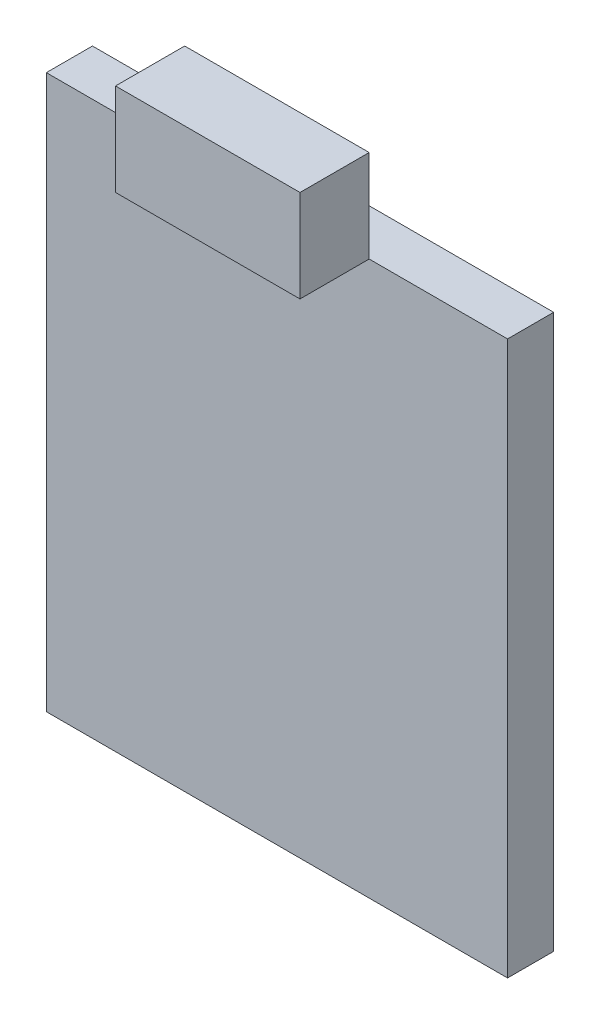
from build123d import *

# Parameters (mm, degrees)
SKETCH1_W           = 15.875
SKETCH1_H           = 19.05
BOSS_EXTRUDE1_DEPTH = 1.5875
SKETCH3_W           = 6.35
SKETCH3_H           = 3.175
BOSS_EXTRUDE3_DEPTH = 2.38125


with BuildPart() as part:
    # Sketch1 → Boss-Extrude1 (new body)
    with BuildSketch(Plane.XY):
        Rectangle(SKETCH1_W, SKETCH1_H)
    extrude(amount=BOSS_EXTRUDE1_DEPTH)


with BuildPart() as body_2:
    # Sketch3 → Boss-Extrude3 (new body)
    with BuildSketch(Plane.XY.offset(1.5875)):
        with Locations((0, 11.1125)):
            Rectangle(SKETCH3_W, SKETCH3_H)
    extrude(amount=BOSS_EXTRUDE3_DEPTH)


solid = Compound([part.part, body_2.part])
